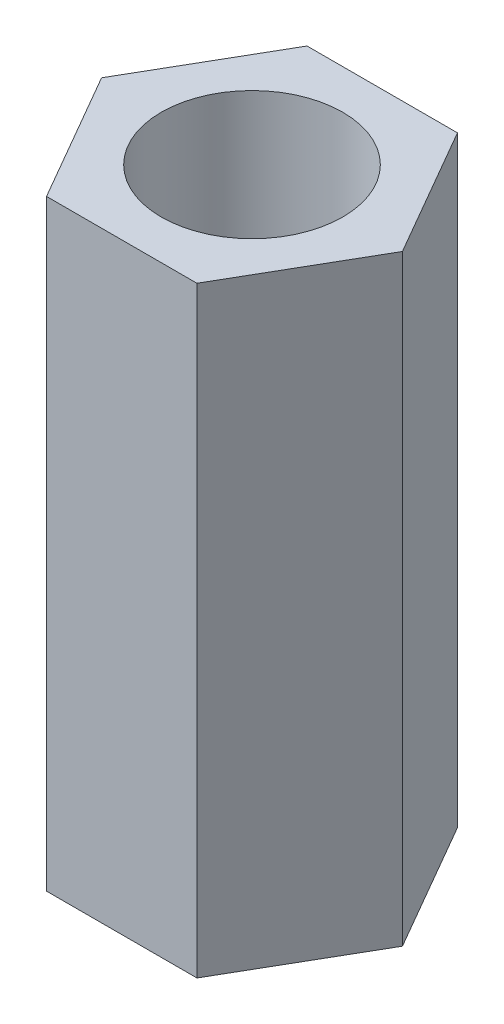
from build123d import *

# Parameters (mm, degrees)
BOSS_EXTRU_1_DEPTH      = 29
ESQUISSE2_R             = 4.375
ENL_V_MAT_EXTRU_1_DEPTH = 29


with BuildPart() as part:
    # Esquisse1 → Boss.-Extru.1 (new body)
    with BuildSketch(Plane(origin=(0, 0, 0), x_dir=(1, 0, 0), z_dir=(0, 1, 0))):
        Polygon((-7.25, 0), (-3.625, -6.278684177), (3.625, -6.278684177), (7.25, 0), (3.625, 6.278684177), (-3.625, 6.278684177), align=None)
    extrude(amount=BOSS_EXTRU_1_DEPTH)

    # Esquisse2 → Enlèv. mat.-Extru.1 (cut)
    with BuildSketch(Plane.XZ):
        with Locations(Location((0, 0, 0), (0, 0, 270))):
            Circle(ESQUISSE2_R)
    extrude(amount=-ENL_V_MAT_EXTRU_1_DEPTH, mode=Mode.SUBTRACT)


solid = part.part
